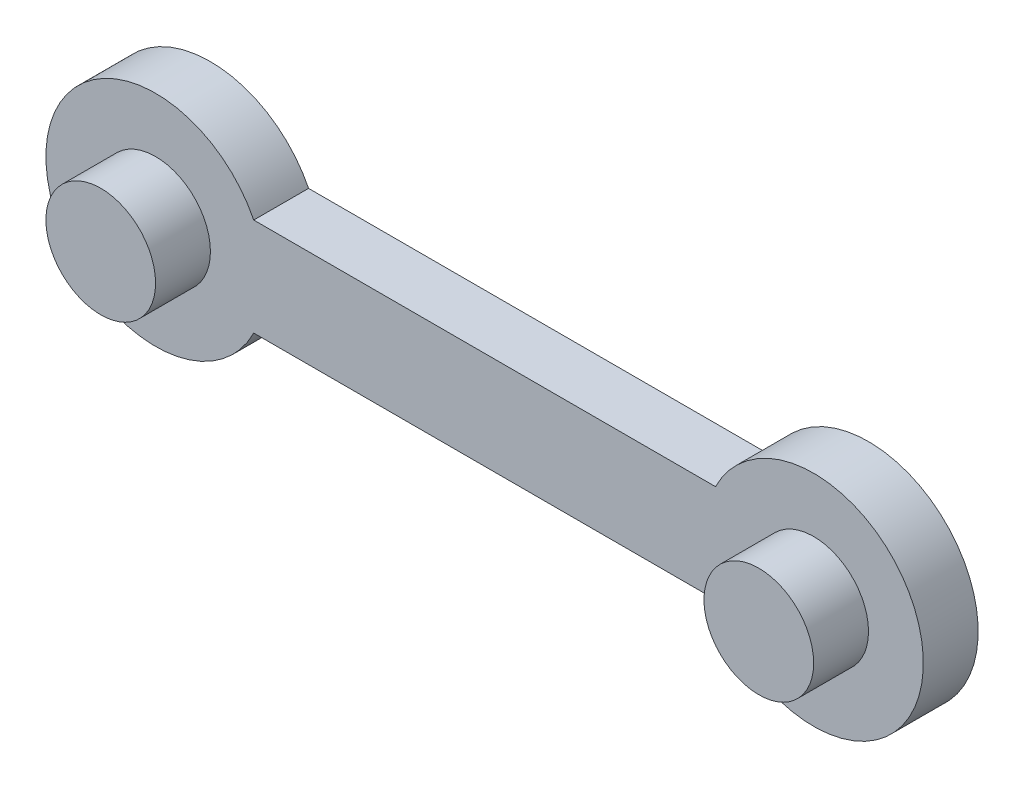
from build123d import *

# Parameters (mm, degrees)
SKETCH_1_R      = 10
EXTRUDE_3_DEPTH = 5
SKETCH_3_R      = 5
EXTRUDE_4_DEPTH = 5
SKETCH_4_R      = 5
EXTRUDE_5_DEPTH = 5


with BuildPart() as part:
    # 草图1 → 凸台-拉伸3 (new body)
    with BuildSketch(Plane.XY):
        Circle(SKETCH_1_R)
        with BuildLine():
            Line((51.049932735, 4.46052642), (8.950067265, 4.46052642))
            ThreePointArc((8.950067265, 4.46052642), (9.733978443, 2.291214454), (10, 0))
            ThreePointArc((10, 0), (9.733978443, -2.291214454), (8.950067265, -4.46052642))
            Line((8.950067265, -4.46052642), (51.049932735, -4.46052642))
            ThreePointArc((51.049932735, -4.46052642), (50, 0), (51.049932735, 4.46052642))
        make_face()
        with Locations((60, 0)):
            Circle(SKETCH_1_R)
    extrude(amount=EXTRUDE_3_DEPTH)

    # 草图3 → 凸台-拉伸4 (add)
    with BuildSketch(Plane.XY.offset(5)):
        with Locations((60, 0)):
            Circle(SKETCH_3_R)
    extrude(amount=EXTRUDE_4_DEPTH)

    # 草图4 → 凸台-拉伸5 (add)
    with BuildSketch(Plane.XY.offset(5)):
        Circle(SKETCH_4_R)
    extrude(amount=EXTRUDE_5_DEPTH)


solid = part.part
